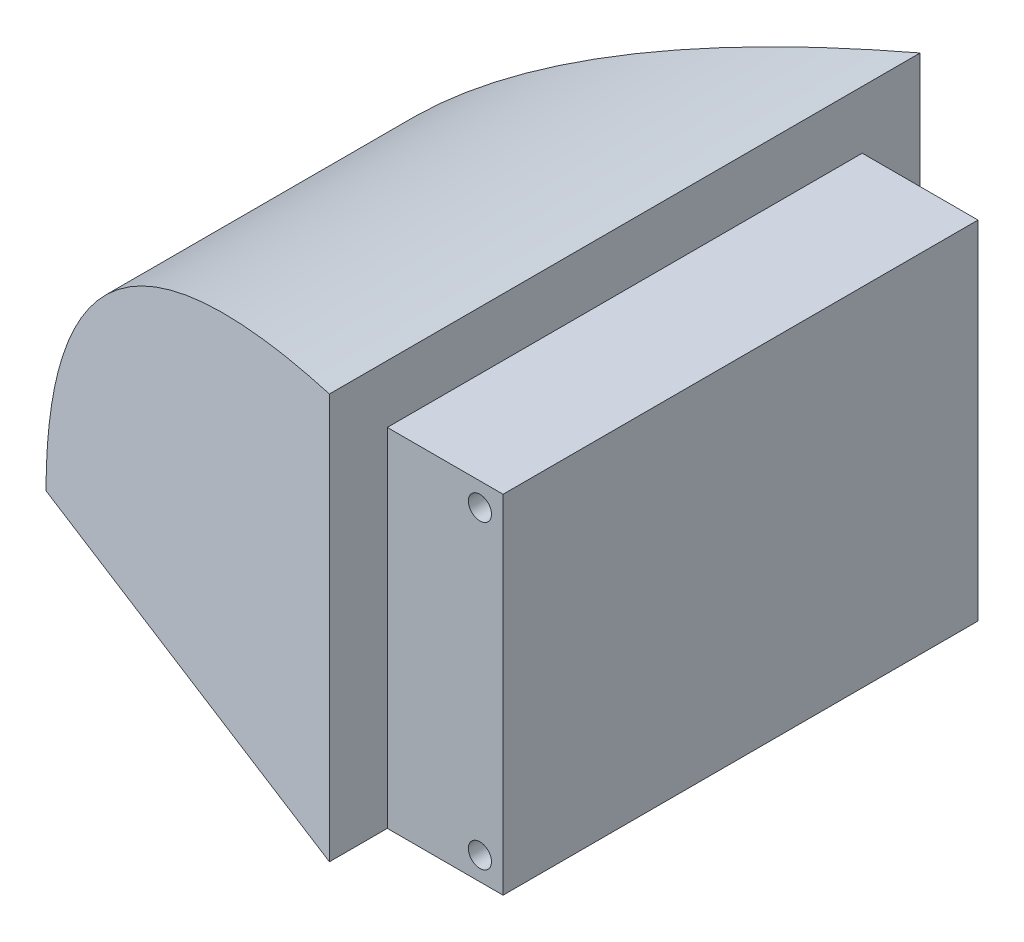
from build123d import *

# Parameters (mm, degrees)
SKETCH_1_W           = 50
SKETCH_1_H           = 35
EXTRUDE_1_DEPTH      = 51.03
SKETCH_2_W           = 10
SKETCH_2_H           = 5
CUT_EXTRUDE_1_DEPTH  = 51.03
CUT_EXTRUDE_16_DEPTH = 60.458480472
CUT_EXTRUDE_17_DEPTH = 67.738751278
SKETCH_13_W          = 41.03
SKETCH_13_H          = 5
CUT_EXTRUDE_18_DEPTH = 10
SKETCH_14_R          = 1
CUT_EXTRUDE_19_DEPTH = 56.22690393


with BuildPart() as part:
    # 草图1 → 凸台-拉伸1 (new body)
    with BuildSketch(Plane.XY):
        Rectangle(SKETCH_1_W, SKETCH_1_H)
    extrude(amount=EXTRUDE_1_DEPTH)

    # 草图2 → 切除-拉伸1 (cut)
    with BuildSketch(Plane(origin=(0, 17.5, 0), x_dir=(1, 0, 0), z_dir=(0, 1, 0))):
        with Locations((20, -2.5)):
            Rectangle(SKETCH_2_W, SKETCH_2_H)
        with Locations((20, -48.53)):
            Rectangle(SKETCH_2_W, SKETCH_2_H)
    extrude(amount=-CUT_EXTRUDE_1_DEPTH, mode=Mode.SUBTRACT)

    # 草图3 → 切除-拉伸16 (cut, through all)
    with BuildSketch(Plane.XY.offset(51.03)):
        with BuildLine():
            add(Edge.make_bspline(
                [(15, 17.5), (-24.901617215, 9.03072155), (-25, -17.5)],
                knots=[0, 0, 0, 0.995080861, 0.995080861, 0.995080861], degree=2))
            Line((15, 17.5), (-25, 17.5))
            Line((-25, 17.5), (-25, -17.5))
        make_face()
    extrude(amount=-CUT_EXTRUDE_16_DEPTH, mode=Mode.SUBTRACT)

    # 草图11 → 切除-拉伸17 (cut, through all)
    with BuildSketch(Plane.XZ.offset(17.5)):
        Polygon((-25, 35.515), (15, 51.03), (-25, 51.03), align=None)
        Polygon((-25, 0), (15, 0), (-25, 15.515), align=None)
    extrude(amount=-CUT_EXTRUDE_17_DEPTH, mode=Mode.SUBTRACT)

    # 草图13 → 切除-拉伸18 (cut)
    with BuildSketch(Plane(origin=(25, 0, 0), x_dir=(0, 0, -1), z_dir=(1, 0, 0))):
        with Locations((-25.515, 15)):
            Rectangle(SKETCH_13_W, SKETCH_13_H)
    extrude(amount=-CUT_EXTRUDE_18_DEPTH, mode=Mode.SUBTRACT)

    # 草图14 → 切除-拉伸19 (cut, through all)
    with BuildSketch(Plane.XY.offset(46.03)):
        with Locations((23, 10.5)):
            Circle(SKETCH_14_R)
        with Locations((23, -15.5)):
            Circle(SKETCH_14_R)
    extrude(amount=-CUT_EXTRUDE_19_DEPTH, mode=Mode.SUBTRACT)


solid = part.part
